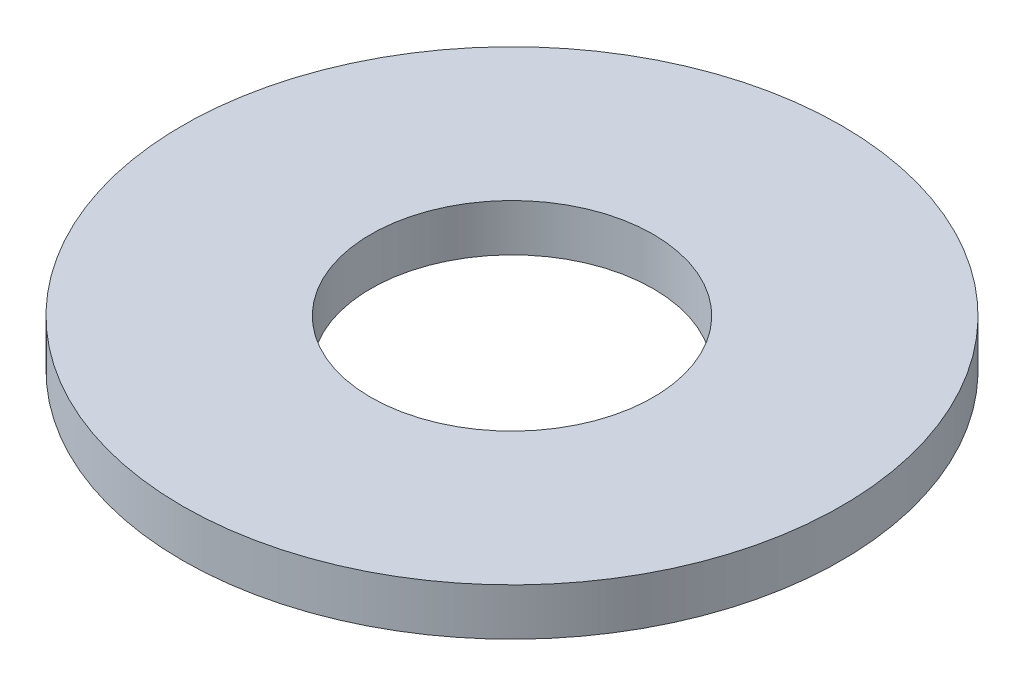
from build123d import *

# Parameters (mm, degrees)
SKETCH1_R           = 35
SKETCH1_R_2         = 15
BOSS_EXTRUDE1_DEPTH = 5


with BuildPart() as part:
    # Sketch1 → Boss-Extrude1 (new body)
    with BuildSketch(Plane(origin=(0, 0, 0), x_dir=(1, 0, 0), z_dir=(0, 1, 0))):
        with Locations(Location((0, 0, 0), (0, 0, 270))):
            Circle(SKETCH1_R)
        with Locations(Location((0, 0, 0), (0, 0, 270))):
            Circle(SKETCH1_R_2, mode=Mode.SUBTRACT)
    extrude(amount=BOSS_EXTRUDE1_DEPTH)


solid = part.part
